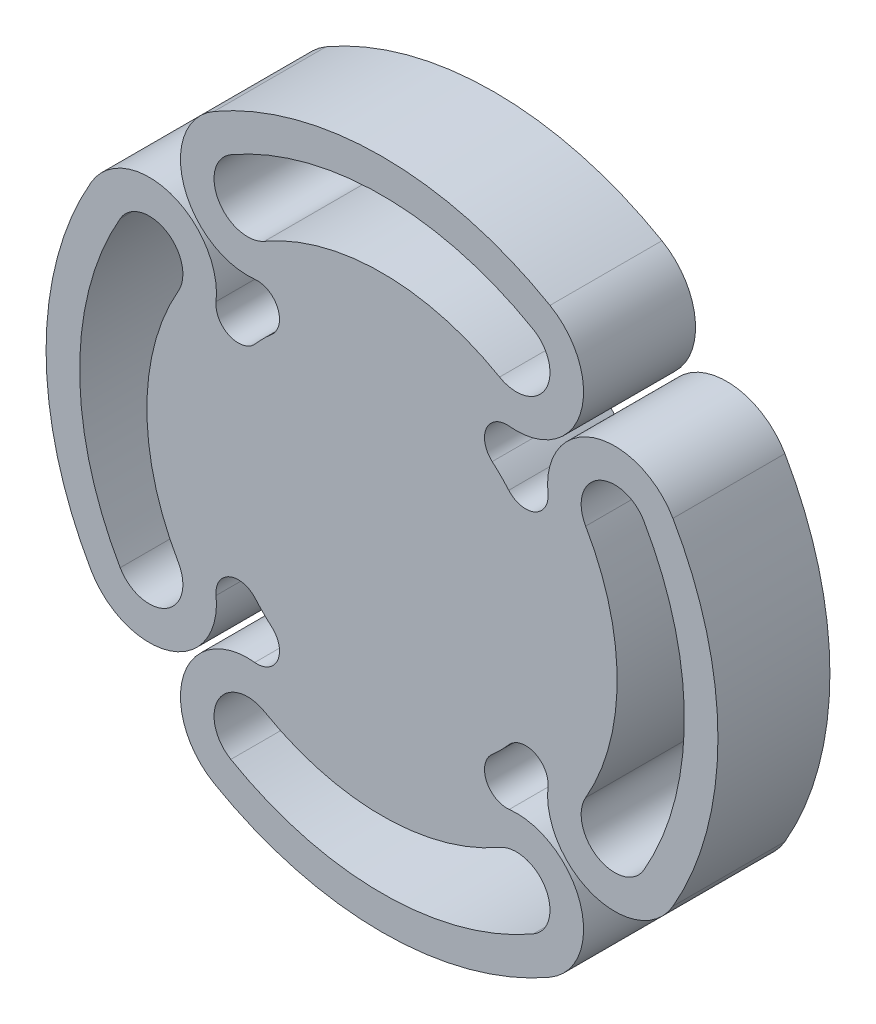
from build123d import *

# Parameters (mm, degrees)
BOSS_EXTRUDE1_DEPTH = 5


with BuildPart() as part:
    # Sketch1 → Boss-Extrude1 (new, symmetric)
    with BuildSketch(Plane.XY):
        with BuildLine():
            ThreePointArc((-9.841451141, 11.320151918), (-10.606601718, 10.606601718), (-11.320151918, 9.841451141))
            ThreePointArc((-11.320151918, 9.841451141), (-13.628216731, 9.32005242), (-14.818281553, 11.36523347))
            ThreePointArc((-14.818281553, 11.36523347), (-18.926875967, 17.70515779), (-25.980762114, 15))
            ThreePointArc((-25.980762114, 15), (-30, 0), (-25.980762114, -15))
            ThreePointArc((-25.980762114, -15), (-18.926875967, -17.70515779), (-14.818281553, -11.36523347))
            ThreePointArc((-14.818281553, -11.36523347), (-13.628216731, -9.32005242), (-11.320151918, -9.841451141))
            ThreePointArc((-11.320151918, -9.841451141), (-10.606601718, -10.606601718), (-9.841451141, -11.320151918))
            ThreePointArc((-9.841451141, -11.320151918), (-9.32005242, -13.628216731), (-11.36523347, -14.818281553))
            ThreePointArc((-11.36523347, -14.818281553), (-17.70515779, -18.926875967), (-15, -25.980762114))
            ThreePointArc((-15, -25.980762114), (0, -30), (15, -25.980762114))
            ThreePointArc((15, -25.980762114), (17.70515779, -18.926875967), (11.36523347, -14.818281553))
            ThreePointArc((11.36523347, -14.818281553), (9.32005242, -13.628216731), (9.841451141, -11.320151918))
            ThreePointArc((9.841451141, -11.320151918), (10.606601718, -10.606601718), (11.320151918, -9.841451141))
            ThreePointArc((11.320151918, -9.841451141), (13.628216731, -9.32005242), (14.818281553, -11.36523347))
            ThreePointArc((14.818281553, -11.36523347), (18.926875967, -17.70515779), (25.980762114, -15))
            ThreePointArc((25.980762114, -15), (30, 0), (25.980762114, 15))
            ThreePointArc((25.980762114, 15), (18.926875967, 17.70515779), (14.818281553, 11.36523347))
            ThreePointArc((14.818281553, 11.36523347), (13.628216731, 9.32005242), (11.320151918, 9.841451141))
            ThreePointArc((11.320151918, 9.841451141), (10.606601718, 10.606601718), (9.841451141, 11.320151918))
            ThreePointArc((9.841451141, 11.320151918), (9.32005242, 13.628216731), (11.36523347, 14.818281553))
            ThreePointArc((11.36523347, 14.818281553), (17.70515779, 18.926875967), (15, 25.980762114))
            ThreePointArc((15, 25.980762114), (0, 30), (-15, 25.980762114))
            ThreePointArc((-15, 25.980762114), (-17.70515779, 18.926875967), (-11.36523347, 14.818281553))
            ThreePointArc((-11.36523347, 14.818281553), (-9.32005242, 13.628216731), (-9.841451141, 11.320151918))
        make_face()
        with BuildLine():
            ThreePointArc((13.5, 23.382685902), (0, 27), (-13.5, 23.382685902))
            ThreePointArc((-13.5, 23.382685902), (-14.598076211, 19.284609691), (-10.5, 18.186533479))
            ThreePointArc((-10.5, 18.186533479), (0, 21), (10.5, 18.186533479))
            ThreePointArc((10.5, 18.186533479), (14.598076211, 19.284609691), (13.5, 23.382685902))
        make_face(mode=Mode.SUBTRACT)
        with BuildLine():
            ThreePointArc((23.382685902, -13.5), (27, 0), (23.382685902, 13.5))
            ThreePointArc((23.382685902, 13.5), (19.284609691, 14.598076211), (18.186533479, 10.5))
            ThreePointArc((18.186533479, 10.5), (21, 0), (18.186533479, -10.5))
            ThreePointArc((18.186533479, -10.5), (19.284609691, -14.598076211), (23.382685902, -13.5))
        make_face(mode=Mode.SUBTRACT)
        with BuildLine():
            ThreePointArc((-13.5, -23.382685902), (0, -27), (13.5, -23.382685902))
            ThreePointArc((13.5, -23.382685902), (14.598076211, -19.284609691), (10.5, -18.186533479))
            ThreePointArc((10.5, -18.186533479), (0, -21), (-10.5, -18.186533479))
            ThreePointArc((-10.5, -18.186533479), (-14.598076211, -19.284609691), (-13.5, -23.382685902))
        make_face(mode=Mode.SUBTRACT)
        with BuildLine():
            ThreePointArc((-23.382685902, 13.5), (-27, 0), (-23.382685902, -13.5))
            ThreePointArc((-23.382685902, -13.5), (-19.284609691, -14.598076211), (-18.186533479, -10.5))
            ThreePointArc((-18.186533479, -10.5), (-21, 0), (-18.186533479, 10.5))
            ThreePointArc((-18.186533479, 10.5), (-19.284609691, 14.598076211), (-23.382685902, 13.5))
        make_face(mode=Mode.SUBTRACT)
    extrude(amount=BOSS_EXTRUDE1_DEPTH, both=True)


solid = part.part
